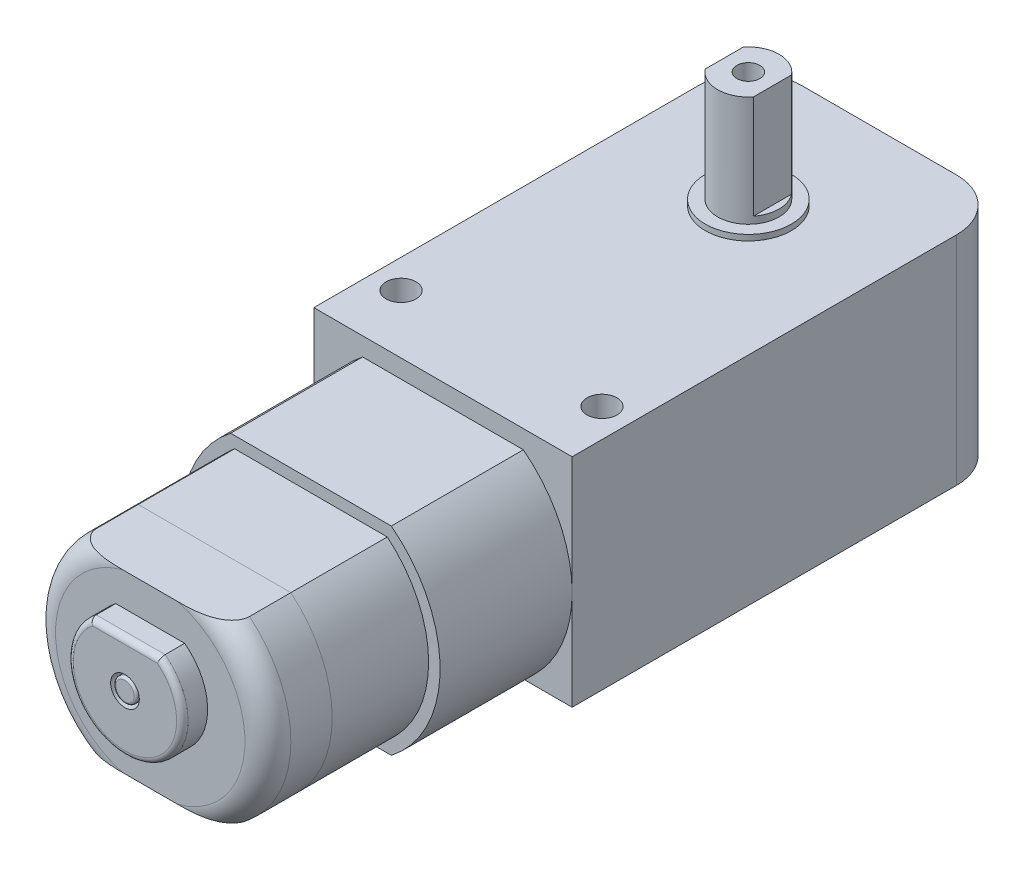
from build123d import *

# Parameters (mm, degrees)
SKETCH1_W              = 22.5
SKETCH1_H              = 38
BOSS_EXTRUDE1_DEPTH    = 9.45
FILLET1_R              = 4.5
BOSS_EXTRUDE2_DEPTH    = 11.5
CUT_EXTRUDE1_DEPTH     = 11.5
SKETCH4_W              = 5
SKETCH4_H              = 5
SKETCH4_R              = 1.25
BOSS_EXTRUDE3_DEPTH    = 1.25
SKETCH5_R              = 3.75
BOSS_EXTRUDE4_DEPTH    = 0.5
SKETCH6_R              = 2.675
BOSS_EXTRUDE5_DEPTH    = 9.6
CUT_EXTRUDE4_START     = -9
CUT_EXTRUDE4_DEPTH     = 9
SKETCH8_R              = 1
CUT_EXTRUDE5_DEPTH     = 9
FILLET2_R              = 0.5
BOSS_EXTRUDE6_DEPTH    = 27.7
SPLIT1_SURFACE_1_BACK  = 80.66
SPLIT1_SURFACE_1_DEPTH = 161.32
SPLIT1_SURFACE_2_BACK  = 80.66
SPLIT1_SURFACE_2_DEPTH = 161.32
CUT_EXTRUDE6_DEPTH     = 2.2
FILLET4_R              = 0.5
FILLET3_R              = 2
SKETCH12_R             = 1.25
CUT_EXTRUDE7_DEPTH     = 2.2
SKETCH13_R             = 1
BOSS_EXTRUDE7_DEPTH    = 2.2
FILLET5_R              = 0.2
SKETCH14_R             = 1.3
CUT_EXTRUDE8_DEPTH     = 18.9


with BuildPart() as part:
    # Sketch1 → Boss-Extrude1 (new, symmetric)
    with BuildSketch(Plane(origin=(0, 0, 0), x_dir=(1, 0, 0), z_dir=(0, 1, 0))):
        Rectangle(SKETCH1_W, SKETCH1_H)
    extrude(amount=BOSS_EXTRUDE1_DEPTH, both=True)

    # Fillet1
    fillet1_edges = [part.edges().sort_by_distance(p)[0] for p in [
        (-11.25, 0, -19),
        (11.25, 0, -19),
    ]]
    fillet(fillet1_edges, radius=FILLET1_R)

    # Sketch2 → Boss-Extrude2 (add)
    with BuildSketch(Plane.XY.offset(19)):
        with BuildLine():
            Line((7, -9.45), (-7, -9.45))
            ThreePointArc((-7, -9.45), (-11.25, -0.8), (-7, 7.85))
            Line((-7, 7.85), (7, 7.85))
            ThreePointArc((7, 7.85), (11.25, -0.8), (7, -9.45))
        make_face()
    extrude(amount=BOSS_EXTRUDE2_DEPTH)

    # Sketch3 → Cut-Extrude1 (cut)
    with BuildSketch(Plane.XY.offset(30.5)):
        with BuildLine():
            Line((-6.649728078, -8.45), (6.649728078, -8.45))
            ThreePointArc((6.649728078, -8.45), (10.25, -0.8), (6.649728078, 6.85))
            Line((6.649728078, 6.85), (-6.649728078, 6.85))
            ThreePointArc((-6.649728078, 6.85), (-10.25, -0.8), (-6.649728078, -8.45))
        make_face()
    extrude(amount=-CUT_EXTRUDE1_DEPTH, mode=Mode.SUBTRACT)

    # Sketch4 → Boss-Extrude3 (add, symmetric)
    with BuildSketch(Plane(origin=(0, 0, 0), x_dir=(1, 0, 0), z_dir=(0, 1, 0))):
        with Locations((0, 21.5)):
            Rectangle(SKETCH4_W, SKETCH4_H)
        with Locations(Location((0, 21.5, 0), (0, 0, 270))):
            Circle(SKETCH4_R, mode=Mode.SUBTRACT)
    extrude(amount=BOSS_EXTRUDE3_DEPTH, both=True)

    # Sketch5 → Boss-Extrude4 (add)
    with BuildSketch(Plane(origin=(0, 9.45, 0), x_dir=(1, 0, 0), z_dir=(0, 1, 0))):
        with Locations(Location((0, 7.6, 0), (0, 0, 90))):
            Circle(SKETCH5_R)
    extrude(amount=BOSS_EXTRUDE4_DEPTH)

    # Sketch6 → Boss-Extrude5 (add)
    with BuildSketch(Plane(origin=(0, 9.95, 0), x_dir=(1, 0, 0), z_dir=(0, 1, 0))):
        with Locations(Location((0, 7.6, 0), (0, 0, 270))):
            Circle(SKETCH6_R)
    extrude(amount=BOSS_EXTRUDE5_DEPTH)

    # Sketch7 → Cut-Extrude4 (cut)
    with BuildSketch(Plane(origin=(0, 19.55, 0), x_dir=(1, 0, 0), z_dir=(0, 1, 0)).offset(CUT_EXTRUDE4_START)):
        with BuildLine():
            Line((-2.1, 9.256992758), (-2.1, 5.943007242))
            ThreePointArc((-2.1, 5.943007242), (-2.675, 7.6), (-2.1, 9.256992758))
        make_face()
        with BuildLine():
            Line((2.1, 9.256992758), (2.1, 5.943007242))
            ThreePointArc((2.1, 5.943007242), (2.675, 7.6), (2.1, 9.256992758))
        make_face()
    extrude(amount=CUT_EXTRUDE4_DEPTH, mode=Mode.SUBTRACT)

    # Sketch8 → Cut-Extrude5 (cut)
    with BuildSketch(Plane(origin=(0, 19.55, 0), x_dir=(1, 0, 0), z_dir=(0, 1, 0))):
        with Locations(Location((0, 7.6, 0), (0, 0, 270))):
            Circle(SKETCH8_R)
    extrude(amount=-CUT_EXTRUDE5_DEPTH, mode=Mode.SUBTRACT)

    # Fillet2
    fillet2_edges = [part.edges().sort_by_distance(p)[0] for p in [
        (-2.5, 0, -24),
        (2.5, 0, -24),
    ]]
    fillet(fillet2_edges, radius=FILLET2_R)

    # Sketch14 → Cut-Extrude8 (cut)
    with BuildSketch(Plane(origin=(0, 9.45, 0), x_dir=(1, 0, 0), z_dir=(0, 1, 0))):
        with Locations(Location((-8.75, -13.9, 0), (0, 0, 270))):
            Circle(SKETCH14_R)
        with Locations(Location((8.75, -13.9, 0), (0, 0, 270))):
            Circle(SKETCH14_R)
    extrude(amount=-CUT_EXTRUDE8_DEPTH, mode=Mode.SUBTRACT)


with BuildPart() as body_2:
    # Sketch9 → Boss-Extrude6 (new body)
    with BuildSketch(Plane.XY.offset(19)):
        with BuildLine():
            Line((-6.649728078, -8.45), (6.649728078, -8.45))
            ThreePointArc((6.649728078, -8.45), (10.25, -0.8), (6.649728078, 6.85))
            Line((6.649728078, 6.85), (-6.649728078, 6.85))
            ThreePointArc((-6.649728078, 6.85), (-10.25, -0.8), (-6.649728078, -8.45))
        make_face()
    extrude(amount=BOSS_EXTRUDE6_DEPTH)


with BuildPart() as body_3:
    # Split1: the piece behind the surface
    add(body_2.part)
    # Split1 surface: a surface, the sketch's curves swept straight by 161.32 mm
    with BuildLine(Plane(origin=(0, 6.85, 0), x_dir=(1, 0, 0), z_dir=(0, 1, 0)).offset(-SPLIT1_SURFACE_1_BACK), mode=Mode.PRIVATE) as split1_surface_1_path:
        Line((-10.25, -38.9), (10.25, -38.9))
    split1_surface_1 = Shell.extrude(split1_surface_1_path.wire(), (0 * SPLIT1_SURFACE_1_DEPTH, 1 * SPLIT1_SURFACE_1_DEPTH, 0 * SPLIT1_SURFACE_1_DEPTH))
    split(bisect_by=split1_surface_1, keep=Keep.BOTTOM)

    # Sketch11 → Cut-Extrude6 (cut)
    with BuildSketch(Plane.XY.offset(46.7)):
        with BuildLine():
            Line((-6.649728078, -8.45), (6.649728078, -8.45))
            ThreePointArc((6.649728078, -8.45), (10.25, -0.8), (6.649728078, 6.85))
            Line((6.649728078, 6.85), (-6.649728078, 6.85))
            ThreePointArc((-6.649728078, 6.85), (-10.25, -0.8), (-6.649728078, -8.45))
        make_face()
        with BuildLine():
            Line((-3, 4), (3, 4))
            ThreePointArc((3, 4), (0, -5), (-3, 4))
        make_face(mode=Mode.SUBTRACT)
    extrude(amount=-CUT_EXTRUDE6_DEPTH, mode=Mode.SUBTRACT)

    # Fillet4
    fillet4_edges = [body_3.edges().sort_by_distance(p)[0] for p in [
        (0, -5, 46.7),
        (0, 4, 46.7),
    ]]
    fillet(fillet4_edges, radius=FILLET4_R)

    # Fillet3
    fillet3_edges = [body_3.edges().sort_by_distance(p)[0] for p in [
        (-10.25, -0.8, 44.5),
        (10.25, -0.8, 44.5),
    ]]
    fillet(fillet3_edges, radius=FILLET3_R)

    # Sketch12 → Cut-Extrude7 (cut)
    with BuildSketch(Plane.XY.offset(46.7)):
        Circle(SKETCH12_R)
    extrude(amount=-CUT_EXTRUDE7_DEPTH, mode=Mode.SUBTRACT)


with BuildPart() as body_2_1:
    add(body_2.part)

    # Split1: split by a surface, the side it looks to stays
    # Split1 surface: a surface, the sketch's curves swept straight by 161.32 mm
    with BuildLine(Plane(origin=(0, 6.85, 0), x_dir=(1, 0, 0), z_dir=(0, 1, 0)).offset(-SPLIT1_SURFACE_2_BACK), mode=Mode.PRIVATE) as split1_surface_2_path:
        Line((-10.25, -38.9), (10.25, -38.9))
    split1_surface_2 = Shell.extrude(split1_surface_2_path.wire(), (0 * SPLIT1_SURFACE_2_DEPTH, 1 * SPLIT1_SURFACE_2_DEPTH, 0 * SPLIT1_SURFACE_2_DEPTH))
    split(bisect_by=split1_surface_2, keep=Keep.TOP)


with BuildPart() as body_4:
    # Sketch13 → Boss-Extrude7 (new body)
    with BuildSketch(Plane.XY.offset(44.5)):
        Circle(SKETCH13_R)
    extrude(amount=BOSS_EXTRUDE7_DEPTH)

    # Fillet5
    fillet5_edges = [body_4.edges().sort_by_distance(p)[0] for p in [
        (-1, 0, 46.7),
    ]]
    fillet(fillet5_edges, radius=FILLET5_R)


solid = Compound([part.part, body_3.part, body_2_1.part, body_4.part])
